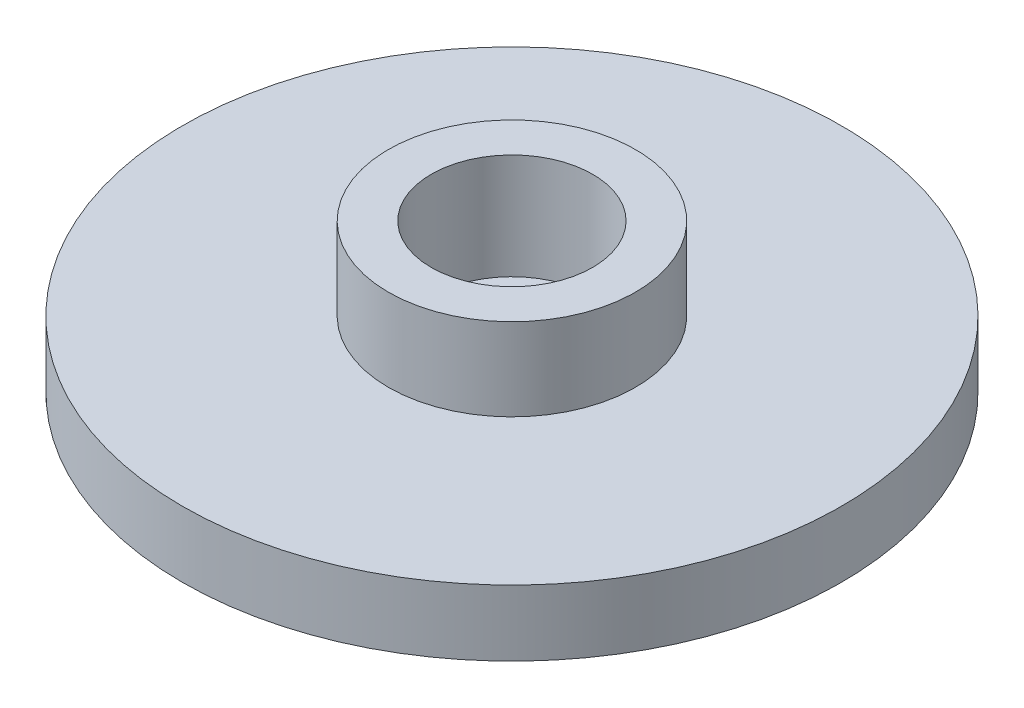
from build123d import *

# Parameters (mm, degrees)
SKETCH_1_R          = 10
SKETCH_1_R_2        = 1.25
EXTRUDE_1_DEPTH     = 2
SKETCH_2_R          = 3.75
EXTRUDE_2_DEPTH     = 2.5
SKETCH_4_R          = 2.45
CUT_EXTRUDE_1_DEPTH = 3.2


with BuildPart() as part:
    # 草图1 → 凸台-拉伸1 (new body)
    with BuildSketch(Plane(origin=(0, 0, 0), x_dir=(1, 0, 0), z_dir=(0, 1, 0))):
        with Locations(Location((0, 0, 0), (0, 0, 270))):
            Circle(SKETCH_1_R)
        with Locations(Location((0, 0, 0), (0, 0, 270))):
            Circle(SKETCH_1_R_2, mode=Mode.SUBTRACT)
    extrude(amount=EXTRUDE_1_DEPTH)

    # 草图2 → 凸台-拉伸2 (add)
    with BuildSketch(Plane(origin=(0, 2, 0), x_dir=(1, 0, 0), z_dir=(0, 1, 0))):
        with Locations(Location((0, 0, 0), (0, 0, 270))):
            Circle(SKETCH_2_R)
    extrude(amount=EXTRUDE_2_DEPTH)

    # 草图4 → 切除-拉伸1 (cut)
    with BuildSketch(Plane(origin=(0, 4.5, 0), x_dir=(1, 0, 0), z_dir=(0, 1, 0))):
        with Locations(Location((0, 0, 0), (0, 0, 270))):
            Circle(SKETCH_4_R)
    extrude(amount=-CUT_EXTRUDE_1_DEPTH, mode=Mode.SUBTRACT)


solid = part.part
